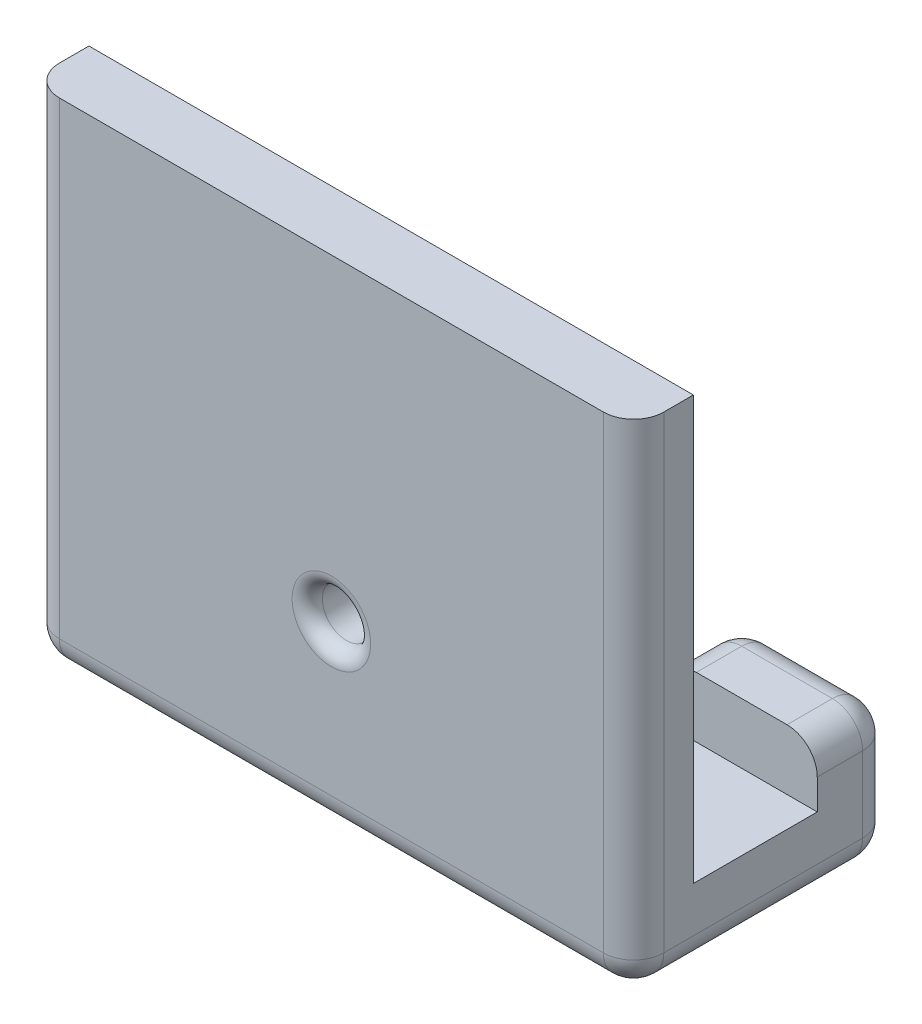
from build123d import *

# Parameters (mm, degrees)
BOSS_EXTRUDE1_DEPTH = 5
SKETCH1_3_W         = 10
SKETCH1_3_H         = 5
BOSS_EXTRUDE2_DEPTH = 9
SKETCH2_W           = 40
SKETCH2_H           = 3.955098896
BOSS_EXTRUDE4_DEPTH = 28
FILLET1_R           = 2
SKETCH6_R           = 1.6
CUT_EXTRUDE1_DEPTH  = 3.955098897
FILLET2_R           = 1


with BuildPart() as part:
    # Sketch1 → Boss-Extrude1 (new body)
    with BuildSketch(Plane(origin=(0, 0, 0), x_dir=(1, 0, 0), z_dir=(0, 1, 0))):
        Polygon((-4.61462686, -18.720861087), (-14.61462686, -18.720861087), (-14.61462686, -25.920861087), (-34.61462686, -25.920861087), (-34.61462686, -18.720861087), (-44.61462686, -18.720861087), (-44.61462686, -35.875959983), (-4.61462686, -35.875959983), align=None)
    extrude(amount=BOSS_EXTRUDE1_DEPTH)

    # Sketch1<3> → Boss-Extrude2 (add)
    with BuildSketch(Plane(origin=(0, 0, 0), x_dir=(1, 0, 0), z_dir=(0, 1, 0))):
        with Locations((-39.61462686, -21.220861087)):
            Rectangle(SKETCH1_3_W, SKETCH1_3_H)
        with Locations((-9.61462686, -21.220861087)):
            Rectangle(SKETCH1_3_W, SKETCH1_3_H)
    extrude(amount=BOSS_EXTRUDE2_DEPTH)

    # Sketch2 → Boss-Extrude4 (add)
    with BuildSketch(Plane(origin=(0, 5, 0), x_dir=(1, 0, 0), z_dir=(0, 1, 0))):
        with Locations((-24.61462686, -33.898410535)):
            Rectangle(SKETCH2_W, SKETCH2_H)
    extrude(amount=BOSS_EXTRUDE4_DEPTH)

    # Fillet1
    fillet1_edges = [part.edges().sort_by_distance(p)[0] for p in [
        (-34.61462686, 0, 22.320861087),
        (-24.61462686, 0, 25.920861087),
        (-14.61462686, 0, 22.320861087),
        (-9.61462686, 0, 18.720861087),
        (-4.61462686, 0, 27.298410535),
        (-24.61462686, 0, 35.875959983),
        (-44.61462686, 0, 27.298410535),
        (-44.61462686, 4.5, 18.720861087),
        (-34.61462686, 4.5, 18.720861087),
        (-14.61462686, 4.5, 18.720861087),
        (-4.61462686, 4.5, 18.720861087),
        (-4.61462686, 16.5, 35.875959983),
        (-44.61462686, 16.5, 35.875959983),
        (-24.61462686, 5, 25.920861087),
        (-39.61462686, 9, 18.720861087),
        (-44.61462686, 9, 21.220861087),
        (-34.61462686, 9, 21.220861087),
        (-14.61462686, 9, 21.220861087),
        (-4.61462686, 9, 21.220861087),
        (-9.61462686, 9, 18.720861087),
        (-39.61462686, 0, 18.720861087),
    ]]
    fillet(fillet1_edges, radius=FILLET1_R)

    # Sketch6 → Cut-Extrude1 (cut)
    with BuildSketch(Plane(origin=(0, 0, 31.920861087), x_dir=(-1, 0, 0), z_dir=(0, 0, -1))):
        with Locations((24.61462686, 12)):
            Circle(SKETCH6_R)
    extrude(amount=-CUT_EXTRUDE1_DEPTH, mode=Mode.SUBTRACT)

    # Fillet2
    fillet2_edges = [part.edges().sort_by_distance(p)[0] for p in [
        (-23.01462686, 12, 31.920861087),
        (-23.01462686, 12, 35.875959984),
    ]]
    fillet(fillet2_edges, radius=FILLET2_R)


solid = part.part
